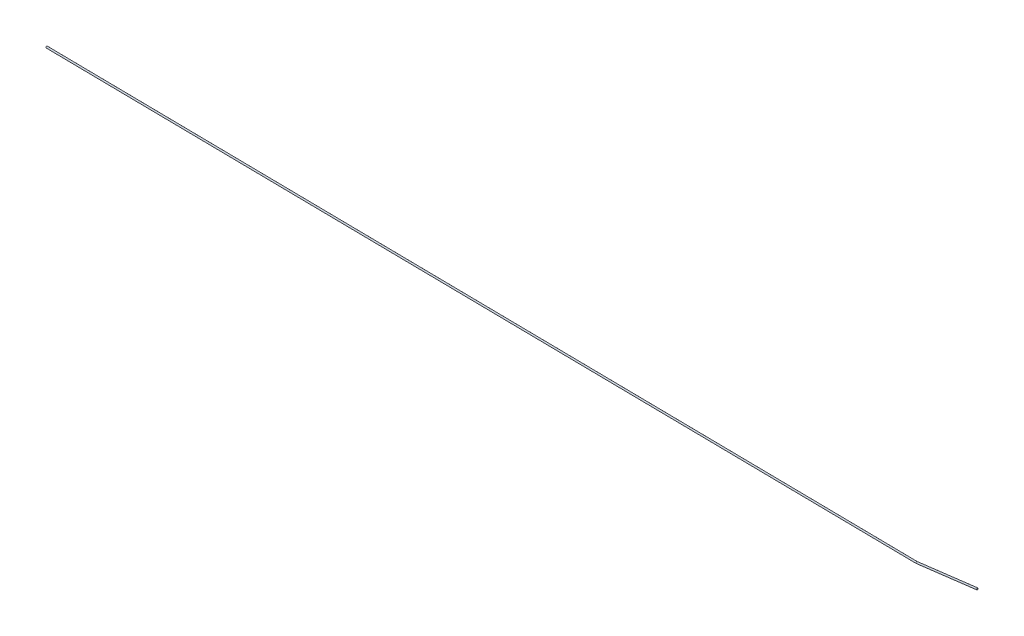
from build123d import *

# Parameters (mm, degrees)
SWEEP1_PROFILE_R = 0.6


with BuildPart() as part:
    # Sweep1: sweep along a curve in space
    with BuildLine() as sweep1_path:
        Line((-340.763210741, -15.766900536, 10.287620049), (323.744029402, -25.106706538, 9.684748233))
        Line((323.744029402, -25.106706538, 9.684748233), (365.07033434, -24.440868738, 4.654767519))
    # Sweep1 profile (on start of the path) → Sweep1 (sweep)
    with BuildSketch(Plane(origin=(-340.763210741, -15.766900536, 10.287620049), x_dir=(0.014053847777846766, 0.9999012398045305, 0), z_dir=(0.9999008283786702, -0.014053841995159253, -0.0009071564497190388))):
        Circle(SWEEP1_PROFILE_R)
    sweep(path=sweep1_path.line, transition=Transition.RIGHT)


solid = part.part
